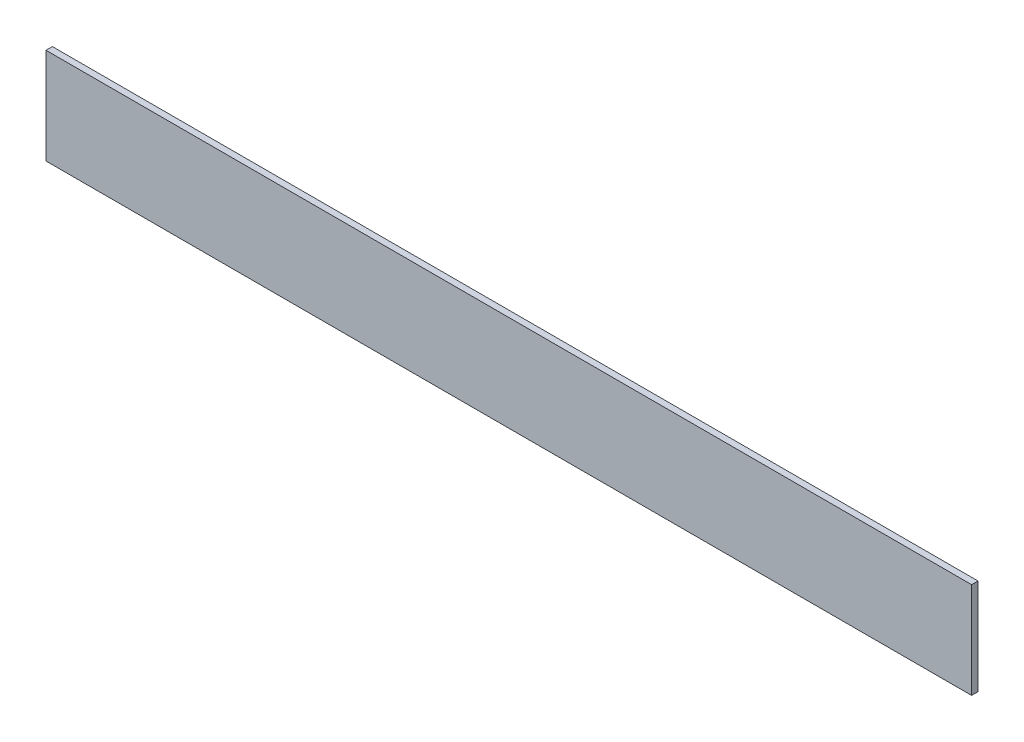
from build123d import *

# Parameters (mm, degrees)
SKETCH1_W           = 459.49
SKETCH1_H           = 47.625
BOSS_EXTRUDE1_DEPTH = 3.175


with BuildPart() as part:
    # Sketch1 → Boss-Extrude1 (new body)
    with BuildSketch(Plane.XY):
        Rectangle(SKETCH1_W, SKETCH1_H)
    extrude(amount=BOSS_EXTRUDE1_DEPTH)


solid = part.part
